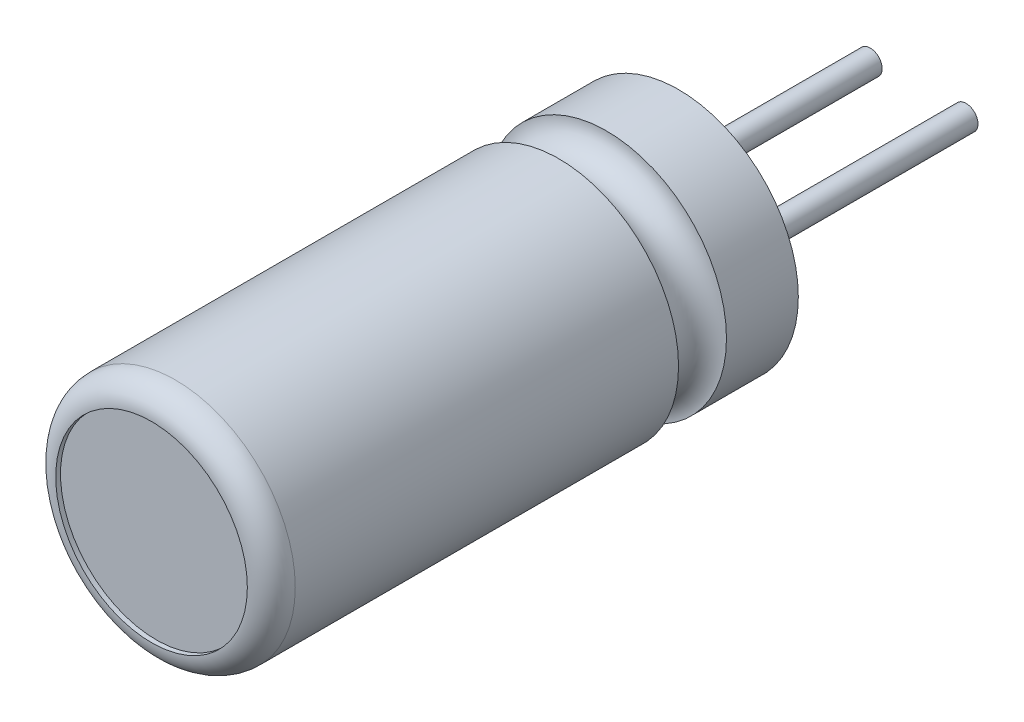
from build123d import *

# Parameters (mm, degrees)
SKETCH3_R           = 2
CUT_EXTRUDE1_DEPTH  = 0.1
SKETCH4_R           = 0.25
BOSS_EXTRUDE1_DEPTH = 5


with BuildPart() as part:
    # Sketch2 → Base-Revolve (revolve)
    with BuildSketch(Plane(origin=(0, 0, 0), x_dir=(0, 0, -1), z_dir=(1, 0, 0)), mode=Mode.PRIVATE) as base_revolve_sk:
        with BuildLine():
            Line((0, 0), (0, 2.5))
            Line((0, 2.5), (-1.5, 2.5))
            ThreePointArc((-1.5, 2.5), (-2, 2), (-2.5, 2.5))
            Line((-2.5, 2.5), (-10.5, 2.5))
            ThreePointArc((-10.5, 2.5), (-10.853553391, 2.353553391), (-11, 2))
            Line((-11, 2), (-11, 0))
            Line((-11, 0), (0, 0))
        make_face()
    revolve(base_revolve_sk.sketch.rotate(Axis((0, 0, 11), (0, 0, -1)), 90), axis=Axis((0, 0, 11), (0, 0, -1)))

    # Sketch3 → Cut-Extrude1 (cut)
    with BuildSketch(Plane.XY.offset(11)):
        Circle(SKETCH3_R)
    extrude(amount=-CUT_EXTRUDE1_DEPTH, mode=Mode.SUBTRACT)

    # Sketch4 → Boss-Extrude1 (add)
    with BuildSketch(Plane(origin=(0, 0, 0), x_dir=(-1, 0, 0), z_dir=(0, 0, -1))):
        with Locations(Location((1, 0, 0), (0, 0, 180))):
            Circle(SKETCH4_R)
        with Locations(Location((-1, 0, 0), (0, 0, 180))):
            Circle(SKETCH4_R)
    extrude(amount=BOSS_EXTRUDE1_DEPTH)


solid = part.part
